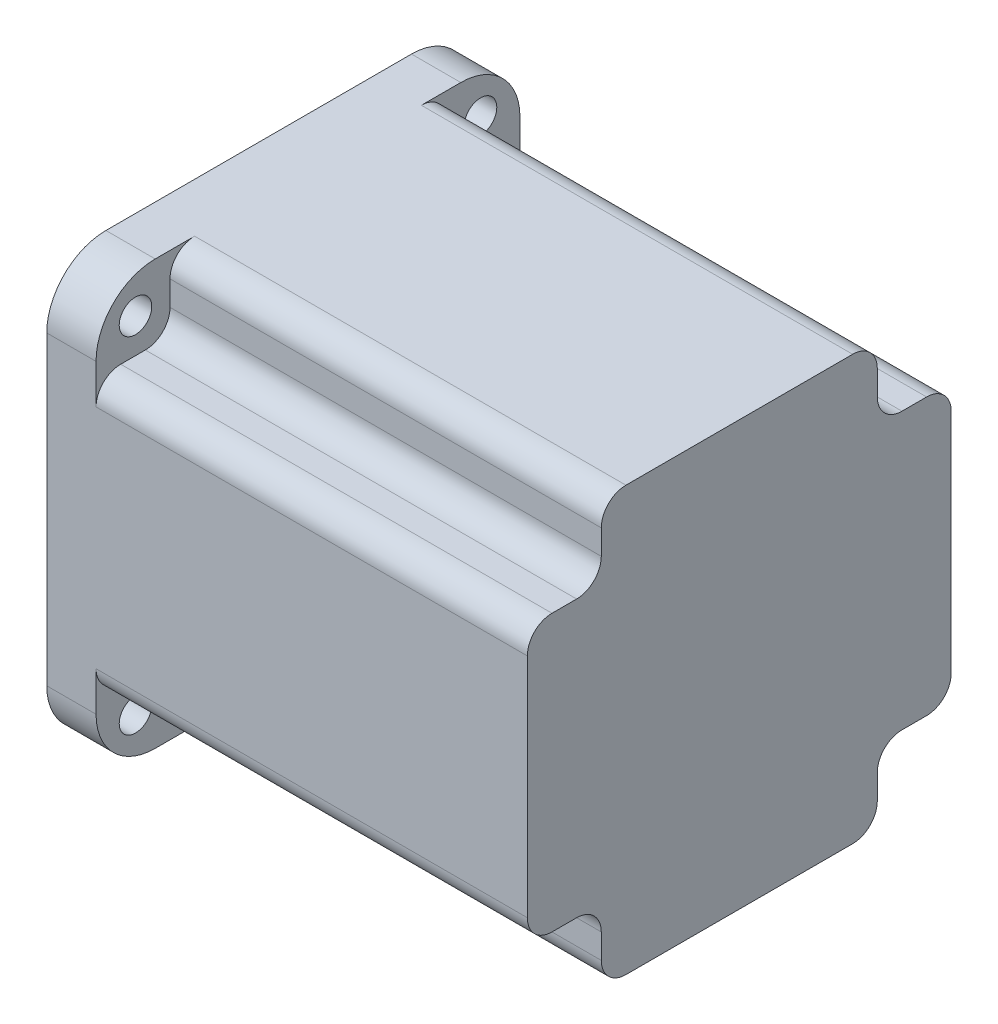
from build123d import *

# Parameters (mm, degrees)
BOSS_EXTRUDE1_DEPTH  = 97.5
SKETCH2_R            = 36.5
BOSS_EXTRUDE2_DEPTH  = 1.6
BOSS_EXTRUDE4_START  = -1.6
SKETCH3_R            = 7
BOSS_EXTRUDE4_DEPTH  = 34
CUT_EXTRUDE1_START   = -24.820064241
CUT_EXTRUDE1_DEPTH   = 24.820064241
SKETCH12_OUTSIDE_W   = 123.824
SKETCH12_OUTSIDE_H   = 123.824
CUT_EXTRUDE2_DEPTH   = 87.5
M6_CLEARANCE_HOLE2_D = 6.6
FILLET1_R            = 5
CHAMFER1_SIZE        = 1


with BuildPart() as part:
    # Sketch1 → Boss-Extrude1 (new body)
    with BuildSketch(Plane(origin=(0, 0, 0), x_dir=(0, 0, -1), z_dir=(1, 0, 0))):
        with BuildLine():
            Line((-31, 43), (31, 43))
            ThreePointArc((31, 43), (39.485281374, 39.485281374), (43, 31))
            Line((43, 31), (43, -31))
            ThreePointArc((43, -31), (39.485281374, -39.485281374), (31, -43))
            Line((31, -43), (-31, -43))
            ThreePointArc((-31, -43), (-39.485281374, -39.485281374), (-43, -31))
            Line((-43, -31), (-43, 31))
            ThreePointArc((-43, 31), (-39.485281374, 39.485281374), (-31, 43))
        make_face()
    extrude(amount=BOSS_EXTRUDE1_DEPTH)

    # Sketch2 → Boss-Extrude2 (add)
    with BuildSketch(Plane.ZY):
        Circle(SKETCH2_R)
    extrude(amount=BOSS_EXTRUDE2_DEPTH)

    # Sketch3 → Boss-Extrude4 (add)
    with BuildSketch(Plane.ZY.offset(1.6).offset(BOSS_EXTRUDE4_START)):
        with Locations(Location((0, 0, 0), (0, 0, 180))):
            Circle(SKETCH3_R)
    extrude(amount=BOSS_EXTRUDE4_DEPTH)

    # Sketch4 → Cut-Extrude1 (cut)
    with BuildSketch(Plane.ZY.offset(34).offset(CUT_EXTRUDE1_START)):
        with BuildLine():
            Line((-4.898979486, 5), (4.898979486, 5))
            ThreePointArc((4.898979486, 5), (0, 7), (-4.898979486, 5))
        make_face()
    extrude(amount=CUT_EXTRUDE1_DEPTH, mode=Mode.SUBTRACT)

    # Sketch12 outside → Cut-Extrude2 (cut)
    with BuildSketch(Plane(origin=(97.5, 0, 0), x_dir=(0, 0, -1), z_dir=(1, 0, 0))):
        Rectangle(SKETCH12_OUTSIDE_W, SKETCH12_OUTSIDE_H)
        Polygon((-28, 43), (28, 43), (28, 28), (43, 28), (43, -28), (28, -28), (28, -43), (-28, -43), (-28, -28), (-43, -28), (-43, 28), (-28, 28), align=None, mode=Mode.SUBTRACT)
    extrude(amount=-CUT_EXTRUDE2_DEPTH, mode=Mode.SUBTRACT)

    # M6 Clearance Hole2 (through all)
    with Locations(Plane.ZY):
        with Locations((-35, 35), (35, 35), (35, -35), (-35, -35)):
            Hole(M6_CLEARANCE_HOLE2_D / 2)

    # Fillet1
    fillet1_edges = [part.edges().sort_by_distance(p)[0] for p in [
        (53.75, 28, 28),
        (53.75, 28, 43),
        (53.75, -28, 43),
        (53.75, -28, 28),
        (53.75, -43, 28),
        (53.75, -43, -28),
        (53.75, -28, -28),
        (53.75, -28, -43),
        (53.75, 28, -43),
        (53.75, 28, -28),
        (53.75, 43, -28),
        (53.75, 43, 28),
    ]]
    fillet(fillet1_edges, radius=FILLET1_R)

    # Chamfer1
    chamfer1_edges = [part.edges().sort_by_distance(p)[0] for p in [
        (-34, -6.453404388, 2.711747002),
    ]]
    chamfer(chamfer1_edges, length=CHAMFER1_SIZE)


solid = part.part
